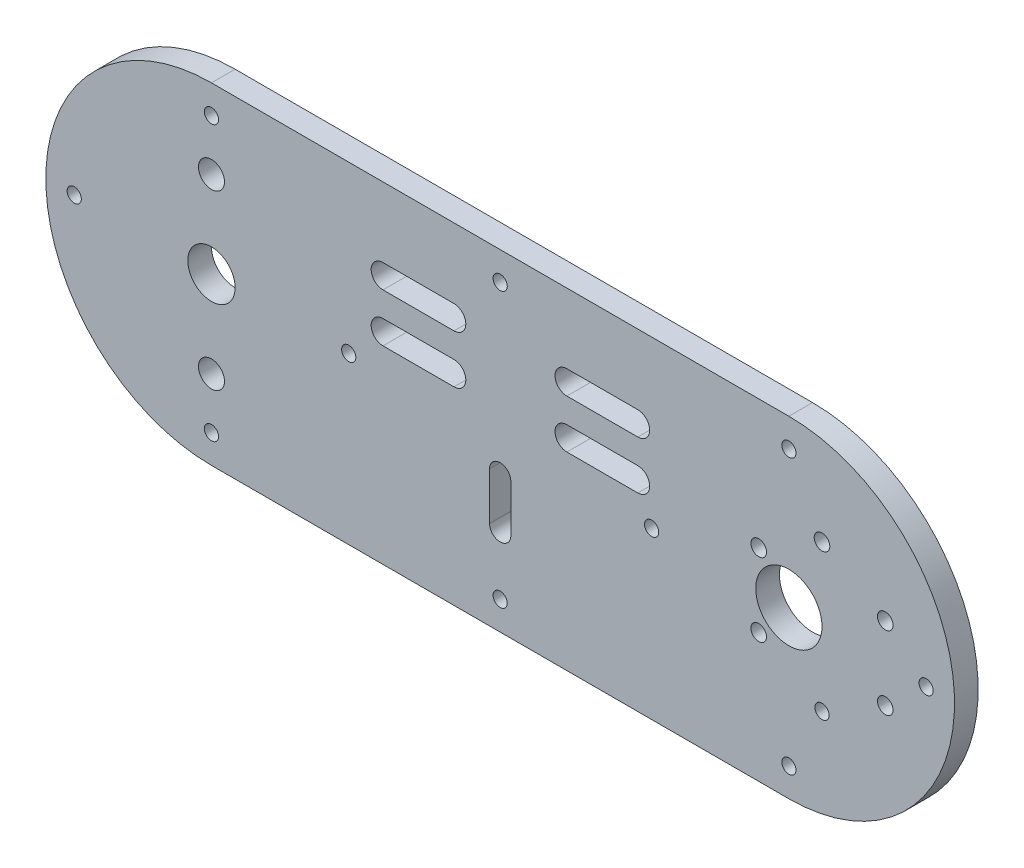
from build123d import *

# Parameters (mm, degrees)
SKETCH1_R           = 7
SKETCH1_R_2         = 5
SKETCH1_R_3         = 1.5
SKETCH1_R_4         = 2.75
SKETCH1_R_5         = 1.65
BOSS_EXTRUDE1_DEPTH = 5


with BuildPart() as part:
    # Sketch1 → Boss-Extrude1 (new body)
    with BuildSketch(Plane.XY):
        with BuildLine():
            Line((61, -35), (-61, -35))
            ThreePointArc((-61, -35), (-96, 0), (-61, 35))
            Line((-61, 35), (61, 35))
            ThreePointArc((61, 35), (96, 0), (61, -35))
        make_face()
        with Locations((61, 0)):
            Circle(SKETCH1_R, mode=Mode.SUBTRACT)
        with Locations((-61, 0)):
            Circle(SKETCH1_R_2, mode=Mode.SUBTRACT)
        with Locations((-61, -29)):
            Circle(SKETCH1_R_3, mode=Mode.SUBTRACT)
        with Locations((-61, 29)):
            Circle(SKETCH1_R_3, mode=Mode.SUBTRACT)
        with Locations((61, 29)):
            Circle(SKETCH1_R_3, mode=Mode.SUBTRACT)
        with Locations((61, -29)):
            Circle(SKETCH1_R_3, mode=Mode.SUBTRACT)
        with Locations((0, -29)):
            Circle(SKETCH1_R_3, mode=Mode.SUBTRACT)
        with Locations((0, 29)):
            Circle(SKETCH1_R_3, mode=Mode.SUBTRACT)
        with Locations((-61, 18.25)):
            Circle(SKETCH1_R_4, mode=Mode.SUBTRACT)
        with Locations((-61, -18.25)):
            Circle(SKETCH1_R_4, mode=Mode.SUBTRACT)
        with Locations((-90, 0)):
            Circle(SKETCH1_R_3, mode=Mode.SUBTRACT)
        with Locations((-32, 0)):
            Circle(SKETCH1_R_3, mode=Mode.SUBTRACT)
        with Locations((90, 0)):
            Circle(SKETCH1_R_3, mode=Mode.SUBTRACT)
        with Locations((32, 0)):
            Circle(SKETCH1_R_3, mode=Mode.SUBTRACT)
        with Locations((68, -15.5)):
            Circle(SKETCH1_R_3, mode=Mode.SUBTRACT)
        with Locations((68, 15.5)):
            Circle(SKETCH1_R_5, mode=Mode.SUBTRACT)
        with Locations((54.630491741, 7.75587519)):
            Circle(SKETCH1_R_5, mode=Mode.SUBTRACT)
        with Locations((54.630491741, -7.75587519)):
            Circle(SKETCH1_R_5, mode=Mode.SUBTRACT)
        with Locations((81.369508259, -7.75587519)):
            Circle(SKETCH1_R_5, mode=Mode.SUBTRACT)
        with Locations((81.369508259, 7.75587519)):
            Circle(SKETCH1_R_5, mode=Mode.SUBTRACT)
        with BuildLine():
            Line((2.25, -6.25), (2.25, -16.25))
            ThreePointArc((2.25, -16.25), (0, -18.5), (-2.25, -16.25))
            Line((-2.25, -16.25), (-2.25, -6.25))
            ThreePointArc((-2.25, -6.25), (0, -4), (2.25, -6.25))
        make_face(mode=Mode.SUBTRACT)
        with BuildLine():
            Line((-24.76, 10), (-9.76, 10))
            ThreePointArc((-9.76, 10), (-7.26, 7.5), (-9.76, 5))
            Line((-9.76, 5), (-24.76, 5))
            ThreePointArc((-24.76, 5), (-27.26, 7.5), (-24.76, 10))
        make_face(mode=Mode.SUBTRACT)
        with BuildLine():
            Line((-24.76, 20.24), (-9.76, 20.24))
            ThreePointArc((-9.76, 20.24), (-7.26, 17.74), (-9.76, 15.24))
            Line((-9.76, 15.24), (-24.76, 15.24))
            ThreePointArc((-24.76, 15.24), (-27.26, 17.74), (-24.76, 20.24))
        make_face(mode=Mode.SUBTRACT)
        with BuildLine():
            Line((14.09, 10), (29.09, 10))
            ThreePointArc((29.09, 10), (31.59, 7.5), (29.09, 5))
            Line((29.09, 5), (14.09, 5))
            ThreePointArc((14.09, 5), (11.59, 7.5), (14.09, 10))
        make_face(mode=Mode.SUBTRACT)
        with BuildLine():
            Line((14.09, 20.24), (29.09, 20.24))
            ThreePointArc((29.09, 20.24), (31.59, 17.74), (29.09, 15.24))
            Line((29.09, 15.24), (14.09, 15.24))
            ThreePointArc((14.09, 15.24), (11.59, 17.74), (14.09, 20.24))
        make_face(mode=Mode.SUBTRACT)
    extrude(amount=BOSS_EXTRUDE1_DEPTH)


solid = part.part
